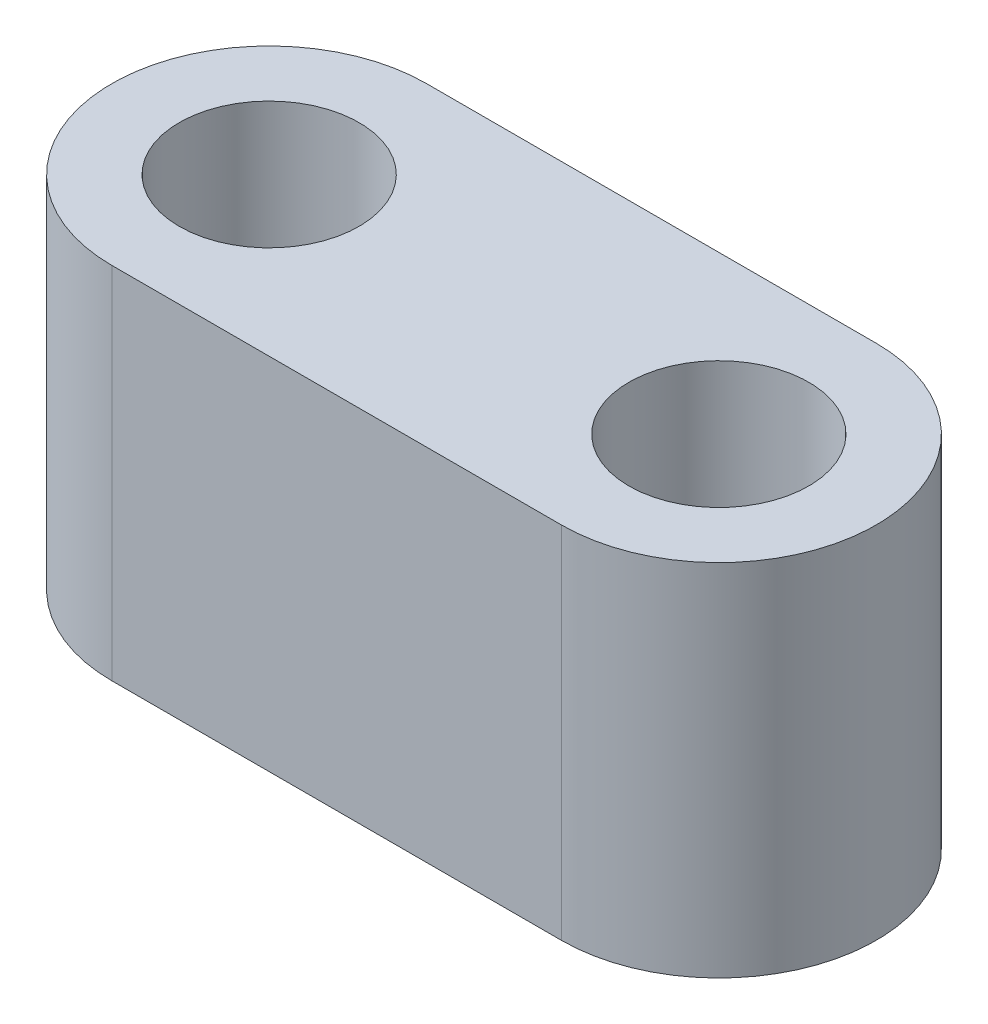
from build123d import *

# Parameters (mm, degrees)
SKETCH1_R           = 1
BOSS_EXTRUDE1_DEPTH = 4


with BuildPart() as part:
    # Sketch1 → Boss-Extrude1 (new body)
    with BuildSketch(Plane(origin=(0, 0, 0), x_dir=(1, 0, 0), z_dir=(0, 1, 0))):
        with BuildLine():
            Line((-2.5, 1.75), (2.5, 1.75))
            ThreePointArc((2.5, 1.75), (4.25, 0), (2.5, -1.75))
            Line((2.5, -1.75), (-2.5, -1.75))
            ThreePointArc((-2.5, -1.75), (-4.25, 0), (-2.5, 1.75))
        make_face()
        with Locations(Location((2.5, 0, 0), (0, 0, 270))):
            Circle(SKETCH1_R, mode=Mode.SUBTRACT)
        with Locations(Location((-2.5, 0, 0), (0, 0, 270))):
            Circle(SKETCH1_R, mode=Mode.SUBTRACT)
    extrude(amount=BOSS_EXTRUDE1_DEPTH)


solid = part.part
